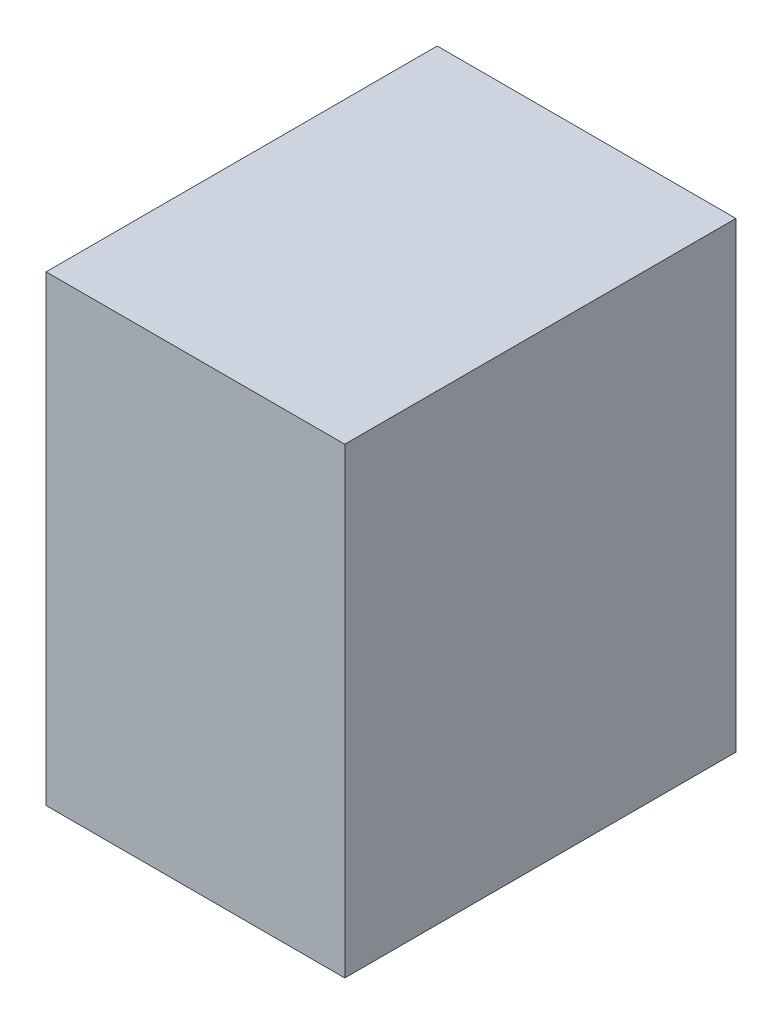
from build123d import *

# Parameters (mm, degrees)
SKETCH_1_W      = 42
SKETCH_1_H      = 55
EXTRUDE_1_DEPTH = 65


with BuildPart() as part:
    # 스케치1 → 보스-돌출1 (new body)
    with BuildSketch(Plane(origin=(0, 0, 0), x_dir=(1, 0, 0), z_dir=(0, 1, 0))):
        Rectangle(SKETCH_1_W, SKETCH_1_H)
    extrude(amount=EXTRUDE_1_DEPTH)


solid = part.part
